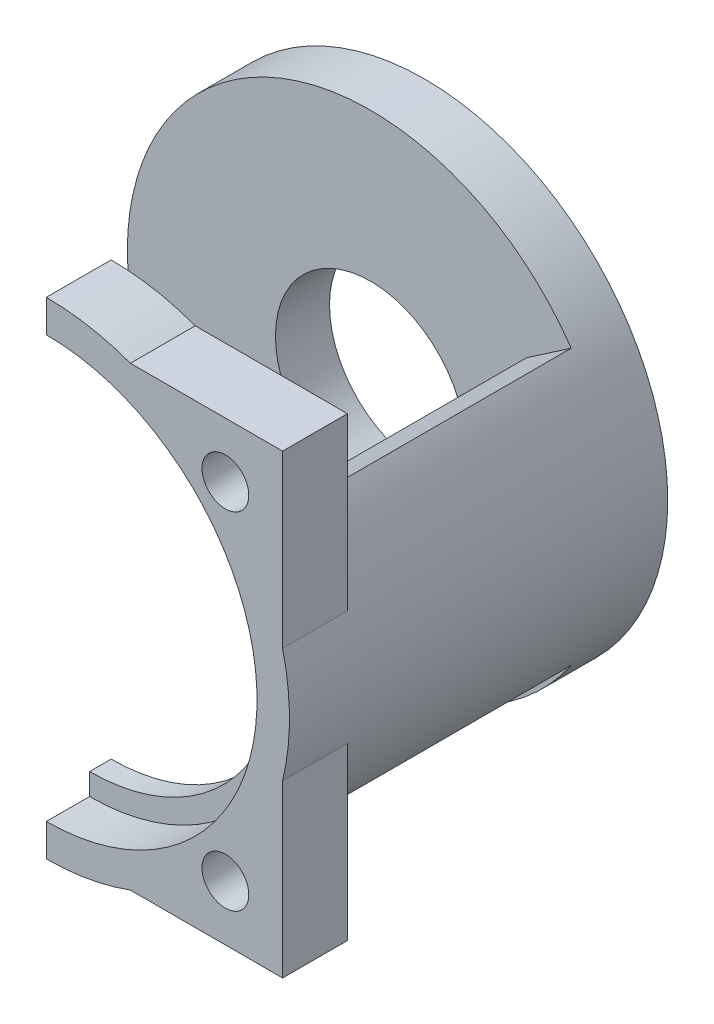
from build123d import *

# Parameters (mm, degrees)
SKETCH1_R           = 22.4995417
SKETCH1_R_2         = 17.4995417
BOSS_EXTRUDE1_DEPTH = 6
CUT_EXTRUDE1_START  = -4
SKETCH2_R           = 19.4995417
SKETCH2_R_2         = 17.4995417
CUT_EXTRUDE1_DEPTH  = 4
BOSS_EXTRUDE2_DEPTH = 6
BOSS_EXTRUDE3_START = 24
BOSS_EXTRUDE3_DEPTH = 24
BOSS_EXTRUDE4_START = 5
SKETCH6_R           = 22.4995417
SKETCH6_R_2         = 8.79453705
BOSS_EXTRUDE4_DEPTH = 5
CUT_EXTRUDE2_DEPTH  = 44.051814752
SKETCH9_R           = 2.165
CUT_EXTRUDE4_DEPTH  = 44.051814752


with BuildPart() as part:
    # Sketch1 → Boss-Extrude1 (new body)
    with BuildSketch(Plane.XY):
        Circle(SKETCH1_R)
        Circle(SKETCH1_R_2, mode=Mode.SUBTRACT)
    extrude(amount=BOSS_EXTRUDE1_DEPTH)

    # Sketch2 → Cut-Extrude1 (cut)
    with BuildSketch(Plane.XY.offset(6).offset(CUT_EXTRUDE1_START)):
        Circle(SKETCH2_R)
        Circle(SKETCH2_R_2, mode=Mode.SUBTRACT)
    extrude(amount=CUT_EXTRUDE1_DEPTH, mode=Mode.SUBTRACT)

    # Sketch3 → Boss-Extrude2 (add, through all)
    with BuildSketch(Plane(origin=(0, 0, 0), x_dir=(-1, 0, 0), z_dir=(0, 0, -1))):
        with BuildLine():
            Line((-7.783576547, 21.11031295), (-21.864631522, 21.11031295))
            Line((-21.864631522, 21.11031295), (-21.864631522, 5.307284156))
            ThreePointArc((-21.864631522, 5.307284156), (-16.798452018, 14.96801211), (-7.783576547, 21.11031295))
        make_face()
        with BuildLine():
            Line((21.864631522, -21.11031295), (7.783576547, -21.11031295))
            ThreePointArc((7.783576547, -21.11031295), (16.798452018, -14.96801211), (21.864631522, -5.307284156))
            Line((21.864631522, -5.307284156), (21.864631522, -21.11031295))
        make_face()
        with BuildLine():
            Line((21.864631522, 21.11031295), (7.783576547, 21.11031295))
            ThreePointArc((7.783576547, 21.11031295), (16.798452018, 14.96801211), (21.864631522, 5.307284156))
            Line((21.864631522, 5.307284156), (21.864631522, 21.11031295))
        make_face()
        with BuildLine():
            Line((-21.864631522, -21.11031295), (-21.864631522, -5.307284156))
            ThreePointArc((-21.864631522, -5.307284156), (-16.798452018, -14.96801211), (-7.783576547, -21.11031295))
            Line((-7.783576547, -21.11031295), (-21.864631522, -21.11031295))
        make_face()
    extrude(amount=-BOSS_EXTRUDE2_DEPTH)

    # Sketch5 → Boss-Extrude3 (add)
    with BuildSketch(Plane(origin=(0, 0, 0), x_dir=(-1, 0, 0), z_dir=(0, 0, -1)).offset(BOSS_EXTRUDE3_START)):
        with BuildLine():
            Line((-14.441527519, 9.883129191), (-18.5677863, 12.706954341))
            ThreePointArc((-18.5677863, 12.706954341), (-22.4995417, 0), (-18.5677863, -12.706954341))
            Line((-18.5677863, -12.706954341), (-14.441527519, -9.883129191))
            ThreePointArc((-14.441527519, -9.883129191), (-17.4995417, 0), (-14.441527519, 9.883129191))
        make_face()
    extrude(amount=-BOSS_EXTRUDE3_DEPTH)

    # Sketch6 → Boss-Extrude4 (add)
    with BuildSketch(Plane(origin=(0, 0, -24), x_dir=(-1, 0, 0), z_dir=(0, 0, -1)).offset(BOSS_EXTRUDE4_START)):
        Circle(SKETCH6_R)
        Circle(SKETCH6_R_2, mode=Mode.SUBTRACT)
    extrude(amount=-BOSS_EXTRUDE4_DEPTH)

    # Sketch7 → Cut-Extrude2 (cut, through all)
    with BuildSketch(Plane(origin=(0, 0, 0), x_dir=(-1, 0, 0), z_dir=(0, 0, -1))):
        Polygon((0, 20.425006128), (0, -31.813494394), (36.314088068, -29.010206824), (38.071070197, 28.399979516), (-0.660202218, 29.585311907), (0, 25.789149152), align=None)
    extrude(amount=-CUT_EXTRUDE2_DEPTH, mode=Mode.SUBTRACT)

    # Sketch9 → Cut-Extrude4 (cut, through all)
    with BuildSketch(Plane(origin=(0, 0, 0), x_dir=(-1, 0, 0), z_dir=(0, 0, -1))):
        with Locations((16.571715691, 16)):
            Circle(SKETCH9_R)
        with Locations((16.571715691, -16)):
            Circle(SKETCH9_R)
        with Locations((-16.571715691, -16)):
            Circle(SKETCH9_R)
        with Locations((-16.571715691, 16)):
            Circle(SKETCH9_R)
    extrude(amount=-CUT_EXTRUDE4_DEPTH, mode=Mode.SUBTRACT)


solid = part.part
